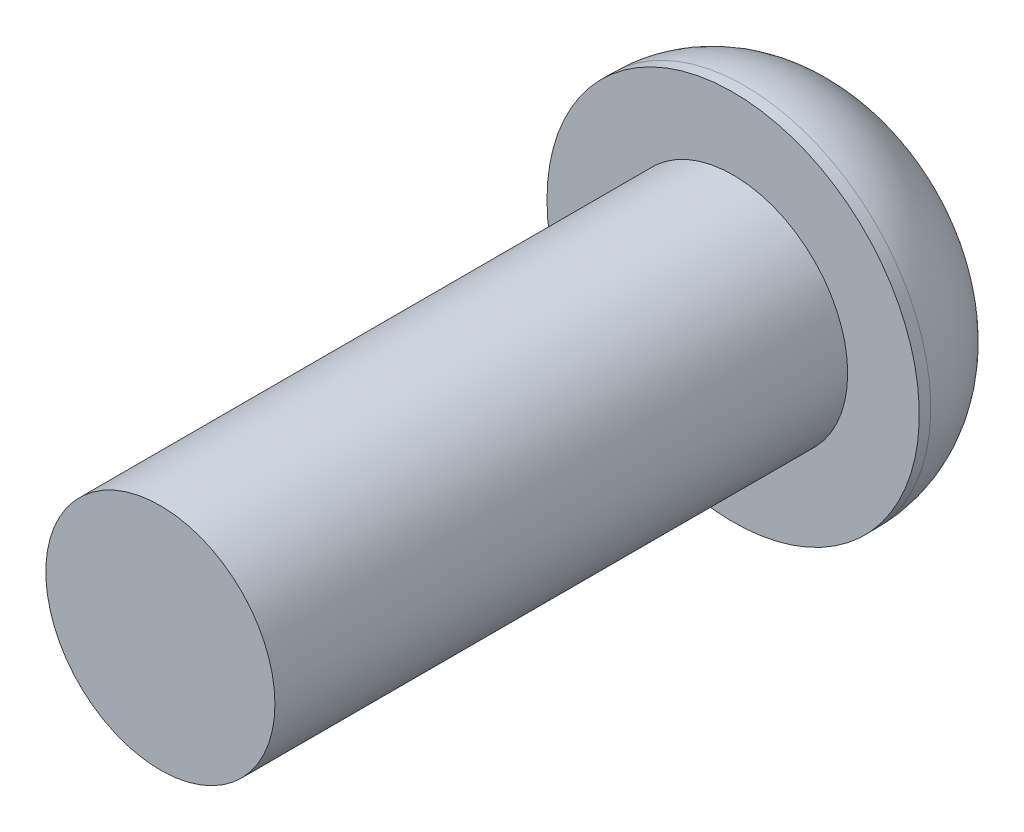
from build123d import *

# Parameters (mm, degrees)
SKETCH_1_R          = 2
EXTRUDE_1_DEPTH     = 10
SKETCH_2_R          = 3.25
EXTRUDE_2_DEPTH     = 2.2
FILLET_1_R          = 2
CUT_EXTRUDE_1_DEPTH = 0.5


with BuildPart() as part:
    # 草图1 → 凸台-拉伸1 (new body)
    with BuildSketch(Plane.XY):
        Circle(SKETCH_1_R)
    extrude(amount=EXTRUDE_1_DEPTH)

    # 草图2 → 凸台-拉伸2 (add)
    with BuildSketch(Plane(origin=(0, 0, 0), x_dir=(-1, 0, 0), z_dir=(0, 0, -1))):
        Circle(SKETCH_2_R)
    extrude(amount=EXTRUDE_2_DEPTH)

    # 圆角1
    fillet_1_edges = [part.edges().sort_by_distance(p)[0] for p in [
        (3.25, 0, -2.2),
    ]]
    fillet(fillet_1_edges, radius=FILLET_1_R)

    # 草图3 → 切除-拉伸1 (cut)
    with BuildSketch(Plane(origin=(0, 0, -2.2), x_dir=(-1, 0, 0), z_dir=(0, 0, -1))):
        Polygon((3.239974874, 0.25), (3.239974874, -0.25), (0.25, -0.25), (0.25, -3.239974874), (-0.25, -3.239974874), (-0.25, -0.25), (-3.239974874, -0.25), (-3.239974874, 0.25), (-0.25, 0.25), (-0.25, 3.239974874), (0.25, 3.239974874), (0.25, 0.25), align=None)
    extrude(amount=-CUT_EXTRUDE_1_DEPTH, mode=Mode.SUBTRACT)


solid = part.part
